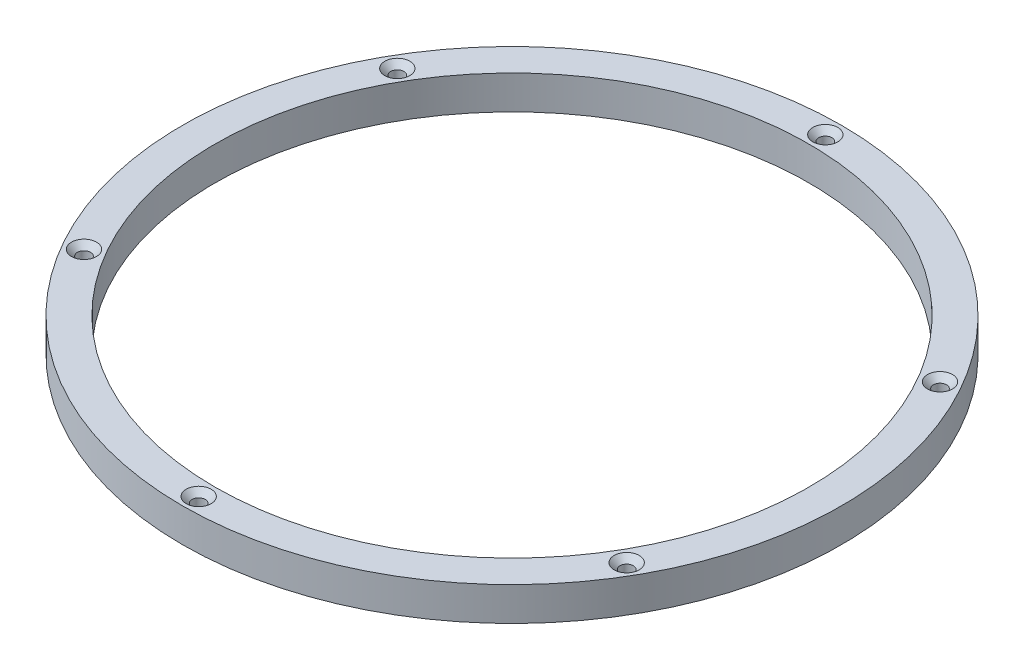
from build123d import *

# Parameters (mm, degrees)
SKETCH1_R                                       = 137
SKETCH1_R_2                                     = 123.5
BOSS_EXTRUDE1_DEPTH                             = 14
CSK_FOR_M5_FLAT_HEAD_MACHINE_SCREW1_D           = 5.5
CSK_FOR_M5_FLAT_HEAD_MACHINE_SCREW1_CSINK_D     = 10.4
CSK_FOR_M5_FLAT_HEAD_MACHINE_SCREW1_CSINK_ANGLE = 90
CIRPATTERN1_COUNT                               = 6


with BuildPart() as part:
    # Sketch1 → Boss-Extrude1 (new body)
    with BuildSketch(Plane(origin=(0, 0, 0), x_dir=(1, 0, 0), z_dir=(0, 1, 0))):
        with Locations(Location((0, 0, 0), (0, 0, 270))):
            Circle(SKETCH1_R)
        with Locations(Location((0, 0, 0), (0, 0, 270))):
            Circle(SKETCH1_R_2, mode=Mode.SUBTRACT)
    extrude(amount=BOSS_EXTRUDE1_DEPTH)

    # CSK for M5 Flat Head Machine Screw1 (through all)
    with Locations(Plane(origin=(0, 14, 0), x_dir=(1, 0, 0), z_dir=(0, 1, 0))):
        with Locations((0, 130.25)):
            csk_for_m5_flat_head_machine_screw1 = CounterSinkHole(CSK_FOR_M5_FLAT_HEAD_MACHINE_SCREW1_D / 2, CSK_FOR_M5_FLAT_HEAD_MACHINE_SCREW1_CSINK_D / 2, counter_sink_angle=CSK_FOR_M5_FLAT_HEAD_MACHINE_SCREW1_CSINK_ANGLE)

    # CirPattern1: CSK for M5 Flat Head Machine Screw1 ×6 about axis
    cirpattern1_axis = Axis((0, 0, 0), (0, 1, 0))
    for i in range(1, CIRPATTERN1_COUNT):
        add(csk_for_m5_flat_head_machine_screw1.rotate(cirpattern1_axis, i * 360 / CIRPATTERN1_COUNT), mode=Mode.SUBTRACT)


solid = part.part
